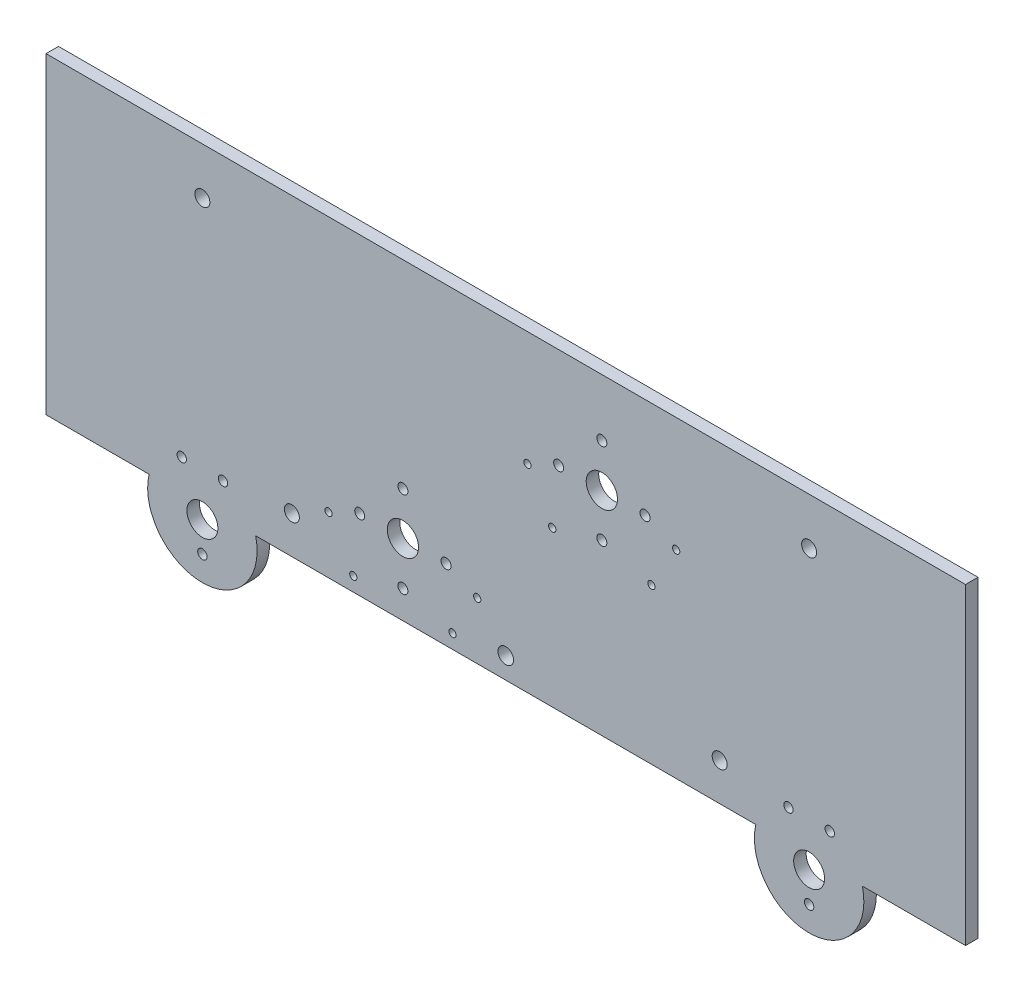
from build123d import *

# Parameters (mm, degrees)
SKETCH2_R           = 3.048
BOSS_EXTRUDE1_DEPTH = 5.07492
SKETCH2_4_R         = 6.2865
CUT_EXTRUDE11_DEPTH = 210.646067011
SKETCH3_R           = 6.35
SKETCH3_R_2         = 2.032
CUT_EXTRUDE12_DEPTH = 210.646067011
SKETCH5_R           = 1.4732
CUT_EXTRUDE13_DEPTH = 210.646067011
SKETCH7_R           = 1.905
CUT_EXTRUDE14_DEPTH = 210.646067011
SKETCH8_R           = 3.175
CUT_EXTRUDE15_DEPTH = 210.646067011


with BuildPart() as part:
    # Sketch2 → Boss-Extrude1 (new body)
    with BuildSketch(Plane.XY):
        with BuildLine():
            Line((-186.69, -31.75), (-144.826640797, -31.75))
            ThreePointArc((-144.826640797, -31.75), (-123.19, -59.055), (-101.553359203, -31.75))
            Line((-101.553359203, -31.75), (101.553359203, -31.75))
            ThreePointArc((101.553359203, -31.75), (123.19, -59.055), (144.826640797, -31.75))
            Line((144.826640797, -31.75), (186.69, -31.75))
            Line((186.69, -31.75), (186.69, 95.25))
            Line((186.69, 95.25), (-186.69, 95.25))
            Line((-186.69, 95.25), (-186.69, -31.75))
        make_face()
        with Locations((-86.868, -16.51)):
            Circle(SKETCH2_R, mode=Mode.SUBTRACT)
        with Locations((86.868, -16.51)):
            Circle(SKETCH2_R, mode=Mode.SUBTRACT)
        with Locations((123.19, 76.2)):
            Circle(SKETCH2_R, mode=Mode.SUBTRACT)
        with Locations((-123.19, 76.2)):
            Circle(SKETCH2_R, mode=Mode.SUBTRACT)
    extrude(amount=-BOSS_EXTRUDE1_DEPTH)

    # Sketch2<4> → Cut-Extrude11 (cut, through all)
    with BuildSketch(Plane.XY):
        with Locations((-123.19, -36.83)):
            Circle(SKETCH2_4_R)
        with Locations((123.19, -36.83)):
            Circle(SKETCH2_4_R)
    extrude(amount=-CUT_EXTRUDE11_DEPTH, mode=Mode.SUBTRACT)

    # Sketch3 → Cut-Extrude12 (cut, through all)
    with BuildSketch(Plane.XY):
        with Locations((-41.770137279, -2.814812764)):
            Circle(SKETCH3_R)
        with Locations((39.019955571, 54.507473453)):
            Circle(SKETCH3_R)
        with Locations((-59.296137279, -2.814812764)):
            Circle(SKETCH3_R_2)
        with Locations((-41.770137279, 14.711187236)):
            Circle(SKETCH3_R_2)
        with Locations((-41.770137279, -20.340812764)):
            Circle(SKETCH3_R_2)
        with Locations((-24.244137279, -2.814812764)):
            Circle(SKETCH3_R_2)
        with Locations((21.493955571, 54.507473453)):
            Circle(SKETCH3_R_2)
        with Locations((56.545955571, 54.507473453)):
            Circle(SKETCH3_R_2)
        with Locations((39.019955571, 72.033473453)):
            Circle(SKETCH3_R_2)
        with Locations((39.019955571, 36.981473453)):
            Circle(SKETCH3_R_2)
    extrude(amount=-CUT_EXTRUDE12_DEPTH, mode=Mode.SUBTRACT)

    # Sketch5 → Cut-Extrude13 (cut, through all)
    with BuildSketch(Plane.XY):
        with Locations((-71.953916856, -8.604303801)):
            Circle(SKETCH5_R)
        with Locations((-11.586357703, -8.604303801)):
            Circle(SKETCH5_R)
        with Locations((-61.907288602, -26.032777632)):
            Circle(SKETCH5_R)
        with Locations((-21.632985956, -26.032777632)):
            Circle(SKETCH5_R)
        with Locations((8.836175995, 48.717982417)):
            Circle(SKETCH5_R)
        with Locations((69.203735148, 48.717982417)):
            Circle(SKETCH5_R)
        with Locations((18.882804248, 31.289508586)):
            Circle(SKETCH5_R)
        with Locations((59.157106894, 31.289508586)):
            Circle(SKETCH5_R)
    extrude(amount=-CUT_EXTRUDE13_DEPTH, mode=Mode.SUBTRACT)

    # Sketch7 → Cut-Extrude14 (cut, through all)
    with BuildSketch(Plane.XY):
        with Locations((131.572, -19.05)):
            Circle(SKETCH7_R)
        with Locations((114.808, -19.05)):
            Circle(SKETCH7_R)
        with Locations((-123.19, -49.022)):
            Circle(SKETCH7_R)
        with Locations((-131.572, -19.05)):
            Circle(SKETCH7_R)
        with Locations((-114.808, -19.05)):
            Circle(SKETCH7_R)
        with Locations((123.19, -49.022)):
            Circle(SKETCH7_R)
    extrude(amount=-CUT_EXTRUDE14_DEPTH, mode=Mode.SUBTRACT)

    # Sketch8 → Cut-Extrude15 (cut, through all)
    with BuildSketch(Plane.XY):
        with Locations((0, -23.114)):
            Circle(SKETCH8_R)
    extrude(amount=-CUT_EXTRUDE15_DEPTH, mode=Mode.SUBTRACT)


solid = part.part
